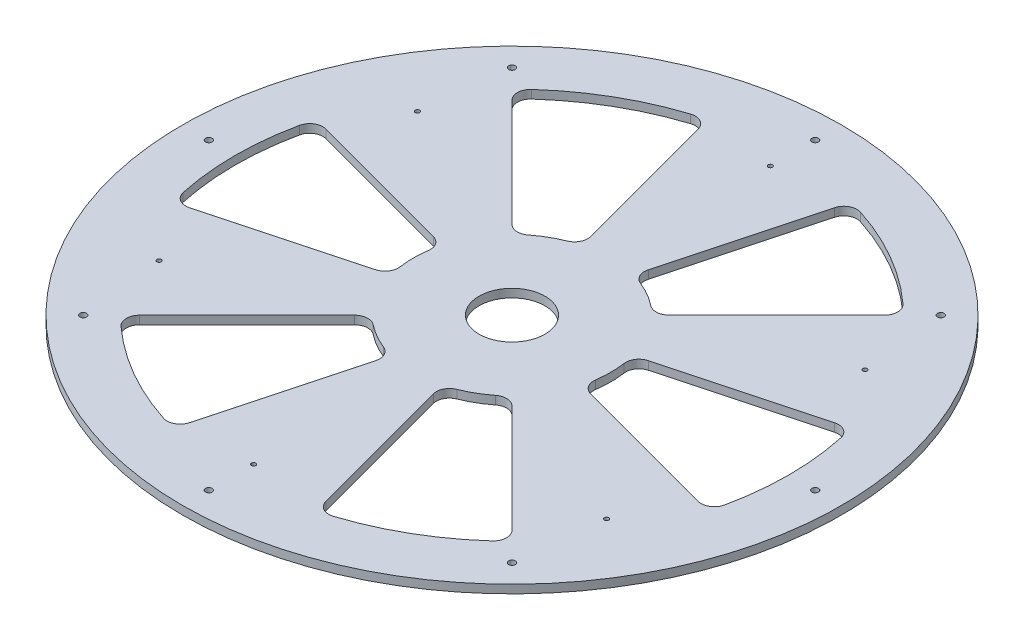
from build123d import *

# Parameters (mm, degrees)
SKETCH1_R                   = 250
SKETCH1_R_2                 = 25
BOSS_EXTRUDE1_DEPTH         = 6.35
TAP_DRILL_FOR_M4X0_7_TAP1_D = 3.3
TAP_DRILL_FOR_M6X1_0_TAP1_D = 5


with BuildPart() as part:
    # Sketch1 → Boss-Extrude1 (new body)
    with BuildSketch(Plane(origin=(0, 0, 0), x_dir=(1, 0, 0), z_dir=(0, 1, 0))):
        with Locations(Location((0, 0, 0), (0, 0, 270))):
            Circle(SKETCH1_R)
        with Locations(Location((0, 0, 0), (0, 0, 270))):
            Circle(SKETCH1_R_2, mode=Mode.SUBTRACT)
        with BuildLine():
            Line((-51.699063768, 192.943532686), (-21.846841855, 81.533523786))
            ThreePointArc((-21.846841855, 81.533523786), (-22.566264891, 74.464334994), (-27.799500104, 69.65764706))
            ThreePointArc((-27.799500104, 69.65764706), (-37.5, 64.951905284), (-46.42554187, 58.903896832))
            ThreePointArc((-46.42554187, 58.903896832), (-53.204873335, 56.775126162), (-59.686681932, 59.686681932))
            Line((-59.686681932, 59.686681932), (-141.244468918, 141.244468918))
            ThreePointArc((-141.244468918, 141.244468918), (-144.170273662, 148.565614941), (-140.882071162, 155.731313567))
            ThreePointArc((-140.882071162, 155.731313567), (-105, 181.865334795), (-64.426238133, 199.873109347))
            ThreePointArc((-64.426238133, 199.873109347), (-56.576459837, 199.137926932), (-51.699063768, 192.943532686))
        make_face(mode=Mode.SUBTRACT)
        with BuildLine():
            Line((141.244468918, 141.244468918), (59.686681932, 59.686681932))
            ThreePointArc((59.686681932, 59.686681932), (53.204873335, 56.775126162), (46.42554187, 58.903896832))
            ThreePointArc((46.42554187, 58.903896832), (37.5, 64.951905284), (27.799500104, 69.65764706))
            ThreePointArc((27.799500104, 69.65764706), (22.566264891, 74.464334994), (21.846841855, 81.533523786))
            Line((21.846841855, 81.533523786), (51.699063768, 192.943532686))
            ThreePointArc((51.699063768, 192.943532686), (56.576459837, 199.137926932), (64.426238133, 199.873109347))
            ThreePointArc((64.426238133, 199.873109347), (105, 181.865334795), (140.882071162, 155.731313567))
            ThreePointArc((140.882071162, 155.731313567), (144.170273662, 148.565614941), (141.244468918, 141.244468918))
        make_face(mode=Mode.SUBTRACT)
        with BuildLine():
            Line((192.943532686, -51.699063768), (81.533523786, -21.846841855))
            ThreePointArc((81.533523786, -21.846841855), (75.771138227, -17.689208833), (74.225041974, -10.753750228))
            ThreePointArc((74.225041974, -10.753750228), (75, 0), (74.225041974, 10.753750228))
            ThreePointArc((74.225041974, 10.753750228), (75.771138227, 17.689208833), (81.533523786, 21.846841855))
            Line((81.533523786, 21.846841855), (192.943532686, 51.699063768))
            ThreePointArc((192.943532686, 51.699063768), (200.746733498, 50.572311991), (205.308309294, 44.14179578))
            ThreePointArc((205.308309294, 44.14179578), (210, 0), (205.308309294, -44.14179578))
            ThreePointArc((205.308309294, -44.14179578), (200.746733498, -50.572311991), (192.943532686, -51.699063768))
        make_face(mode=Mode.SUBTRACT)
        with BuildLine():
            Line((51.699063768, -192.943532686), (21.846841855, -81.533523786))
            ThreePointArc((21.846841855, -81.533523786), (22.566264891, -74.464334994), (27.799500104, -69.65764706))
            ThreePointArc((27.799500104, -69.65764706), (37.5, -64.951905284), (46.42554187, -58.903896832))
            ThreePointArc((46.42554187, -58.903896832), (53.204873335, -56.775126162), (59.686681932, -59.686681932))
            Line((59.686681932, -59.686681932), (141.244468918, -141.244468918))
            ThreePointArc((141.244468918, -141.244468918), (144.170273662, -148.565614941), (140.882071162, -155.731313567))
            ThreePointArc((140.882071162, -155.731313567), (105, -181.865334795), (64.426238133, -199.873109347))
            ThreePointArc((64.426238133, -199.873109347), (56.576459837, -199.137926932), (51.699063768, -192.943532686))
        make_face(mode=Mode.SUBTRACT)
        with BuildLine():
            Line((-141.244468918, -141.244468918), (-59.686681932, -59.686681932))
            ThreePointArc((-59.686681932, -59.686681932), (-53.204873335, -56.775126162), (-46.42554187, -58.903896832))
            ThreePointArc((-46.42554187, -58.903896832), (-37.5, -64.951905284), (-27.799500104, -69.65764706))
            ThreePointArc((-27.799500104, -69.65764706), (-22.566264891, -74.464334994), (-21.846841855, -81.533523786))
            Line((-21.846841855, -81.533523786), (-51.699063768, -192.943532686))
            ThreePointArc((-51.699063768, -192.943532686), (-56.576459837, -199.137926932), (-64.426238133, -199.873109347))
            ThreePointArc((-64.426238133, -199.873109347), (-105, -181.865334795), (-140.882071162, -155.731313567))
            ThreePointArc((-140.882071162, -155.731313567), (-144.170273662, -148.565614941), (-141.244468918, -141.244468918))
        make_face(mode=Mode.SUBTRACT)
        with BuildLine():
            Line((-192.943532686, 51.699063768), (-81.533523786, 21.846841855))
            ThreePointArc((-81.533523786, 21.846841855), (-75.771138227, 17.689208833), (-74.225041974, 10.753750228))
            ThreePointArc((-74.225041974, 10.753750228), (-75, 0), (-74.225041974, -10.753750228))
            ThreePointArc((-74.225041974, -10.753750228), (-75.771138227, -17.689208833), (-81.533523786, -21.846841855))
            Line((-81.533523786, -21.846841855), (-192.943532686, -51.699063768))
            ThreePointArc((-192.943532686, -51.699063768), (-200.746733498, -50.572311991), (-205.308309294, -44.14179578))
            ThreePointArc((-205.308309294, -44.14179578), (-210, 0), (-205.308309294, 44.14179578))
            ThreePointArc((-205.308309294, 44.14179578), (-200.746733498, 50.572311991), (-192.943532686, 51.699063768))
        make_face(mode=Mode.SUBTRACT)
    extrude(amount=-BOSS_EXTRUDE1_DEPTH)

    # Tap Drill for M4x0.7 Tap1 (through all)
    with Locations(Plane(origin=(0, 0, -196), x_dir=(0, 0, 1), z_dir=(0, 1, 0))):
        with Locations((0, 0), (98, -169.740979142), (98, 169.740979142), (294, 169.740979142), (294, -169.740979142), (392, 0)):
            Hole(TAP_DRILL_FOR_M4X0_7_TAP1_D / 2)

    # Tap Drill for M6x1.0 Tap1 (through all)
    with Locations(Plane(origin=(0, 0, -230), x_dir=(0, 0, 1), z_dir=(0, 1, 0))):
        with Locations((0, 0), (67.365440327, 162.634559673), (230, 230), (230, -230), (67.365440327, -162.634559673), (460, 0), (392.634559673, -162.634559673), (392.634559673, 162.634559673)):
            Hole(TAP_DRILL_FOR_M6X1_0_TAP1_D / 2)


solid = part.part
